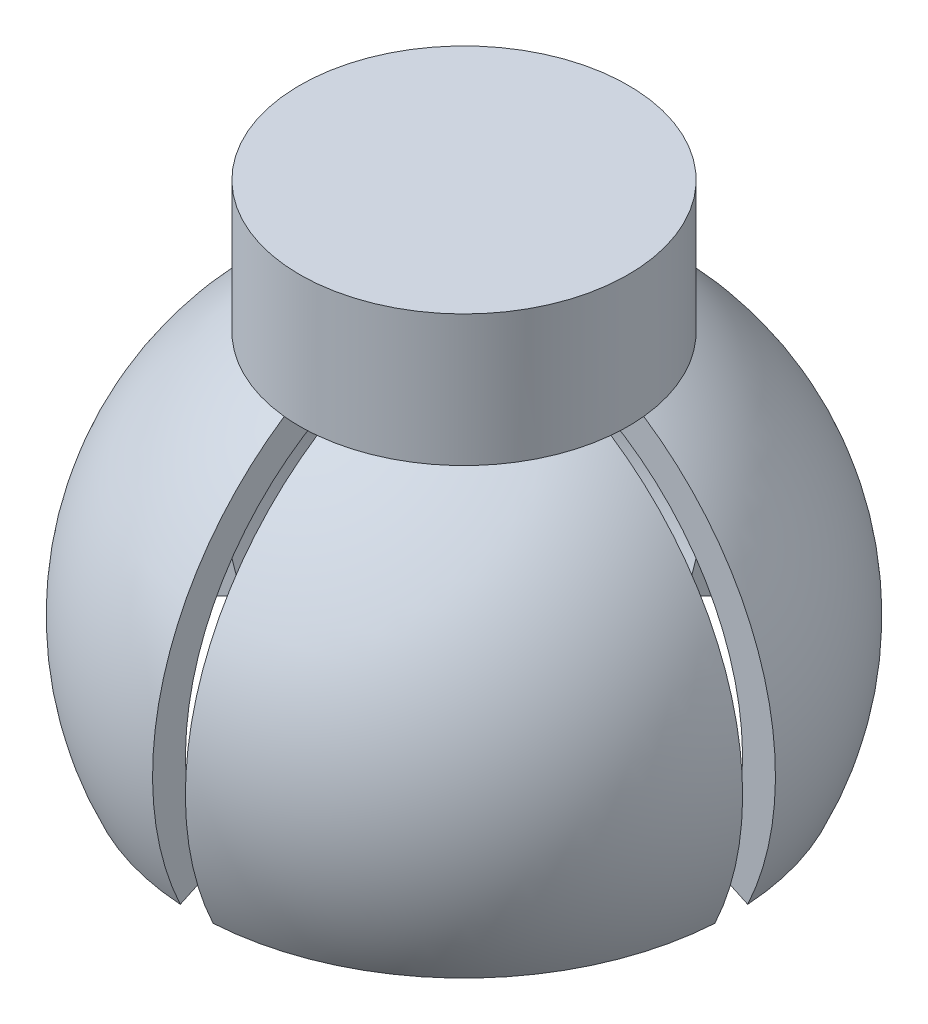
from build123d import *

# Parameters (mm, degrees)
SKETCH2_W          = 0.5
SKETCH2_H          = 5.643439565
CUT_EXTRUDE1_DEPTH = 10
CIRPATTERN1_COUNT  = 4


with BuildPart() as part:
    # Sketch1 → Revolve1 (revolve)
    with BuildSketch(Plane.XY):
        with BuildLine():
            Line((0, 5.741657387), (0, 4))
            ThreePointArc((0, 4), (3.373565783, 2.149198433), (3.625231148, -1.690473047))
            Line((3.625231148, -1.690473047), (4.078385042, -1.901782178))
            ThreePointArc((4.078385042, -1.901782178), (4.333692417, 1.212068493), (2.5, 3.741657387))
            Line((2.5, 3.741657387), (2.5, 5.741657387))
            Line((2.5, 5.741657387), (0, 5.741657387))
        make_face()
    revolve(axis=Axis((0, 5.741657387, 0), (0, -1, 0)))

    # Sketch2 → Cut-Extrude1 (cut)
    with BuildSketch(Plane.XY):
        with Locations((0, 0.919937604)):
            Rectangle(SKETCH2_W, SKETCH2_H)
    cut_extrude1 = extrude(amount=-CUT_EXTRUDE1_DEPTH, mode=Mode.SUBTRACT)

    # CirPattern1: Cut-Extrude1 ×4 about axis
    cirpattern1_axis = Axis((0, 0, 0), (0, 1, 0))
    for i in range(1, CIRPATTERN1_COUNT):
        add(cut_extrude1.rotate(cirpattern1_axis, i * 360 / CIRPATTERN1_COUNT), mode=Mode.SUBTRACT)


solid = part.part
